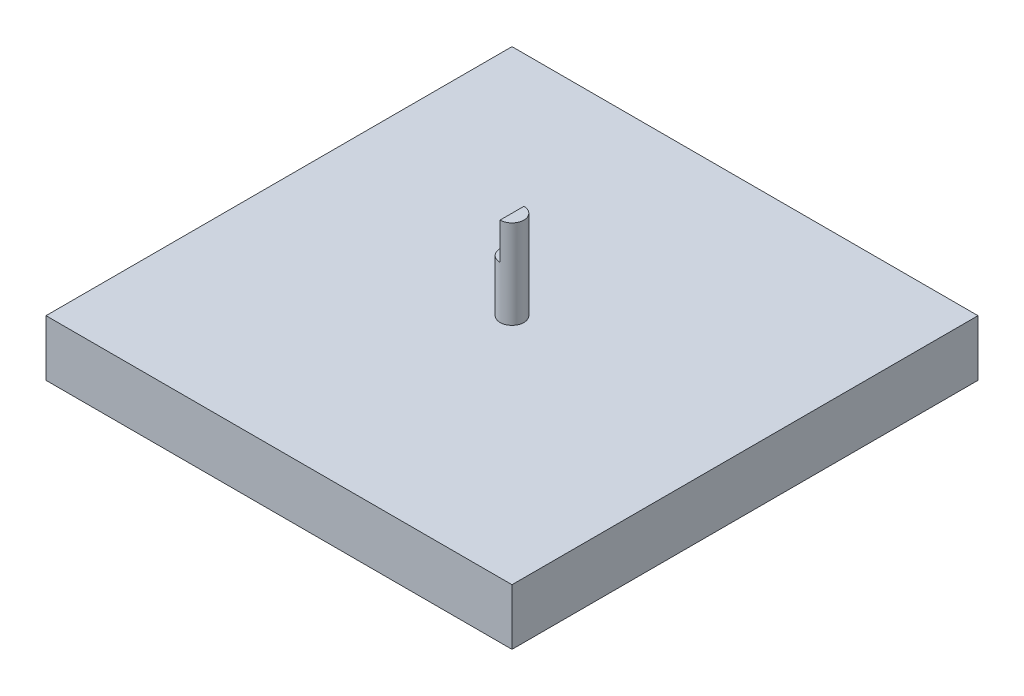
from build123d import *

# Parameters (mm, degrees)
SKETCH1_W           = 94
SKETCH1_H           = 94
BOSS_EXTRUDE1_DEPTH = 11.3
SKETCH2_R           = 1.9
BOSS_EXTRUDE2_DEPTH = 2
SKETCH3_R           = 2.4
BOSS_EXTRUDE3_DEPTH = 17.9
SKETCH4_W           = 4
SKETCH4_H           = 7
CUT_EXTRUDE1_DEPTH  = 7.4


with BuildPart() as part:
    # Sketch1 → Boss-Extrude1 (new body)
    with BuildSketch(Plane(origin=(0, 0, 0), x_dir=(1, 0, 0), z_dir=(0, 1, 0))):
        with Locations((47, 47)):
            Rectangle(SKETCH1_W, SKETCH1_H)
    extrude(amount=BOSS_EXTRUDE1_DEPTH)

    # Sketch2 → Boss-Extrude2 (add)
    with BuildSketch(Plane.XZ):
        with Locations(Location((6.4, -6.4, 0), (0, 0, 270))):
            Circle(SKETCH2_R)
        with Locations(Location((6.4, -87.6, 0), (0, 0, 90))):
            Circle(SKETCH2_R)
        with Locations(Location((87.6, -87.6, 0), (0, 0, 270))):
            Circle(SKETCH2_R)
        with Locations(Location((87.6, -6.4, 0), (0, 0, 90))):
            Circle(SKETCH2_R)
    extrude(amount=BOSS_EXTRUDE2_DEPTH)

    # Sketch3 → Boss-Extrude3 (add)
    with BuildSketch(Plane(origin=(0, 11.3, 0), x_dir=(1, 0, 0), z_dir=(0, 1, 0))):
        with Locations(Location((47, 47, 0), (0, 0, 90))):
            Circle(SKETCH3_R)
    extrude(amount=BOSS_EXTRUDE3_DEPTH)

    # Sketch4 → Cut-Extrude1 (cut)
    with BuildSketch(Plane(origin=(0, 29.2, 0), x_dir=(1, 0, 0), z_dir=(0, 1, 0))):
        with Locations((45, 45.9)):
            Rectangle(SKETCH4_W, SKETCH4_H)
    extrude(amount=-CUT_EXTRUDE1_DEPTH, mode=Mode.SUBTRACT)


solid = part.part
